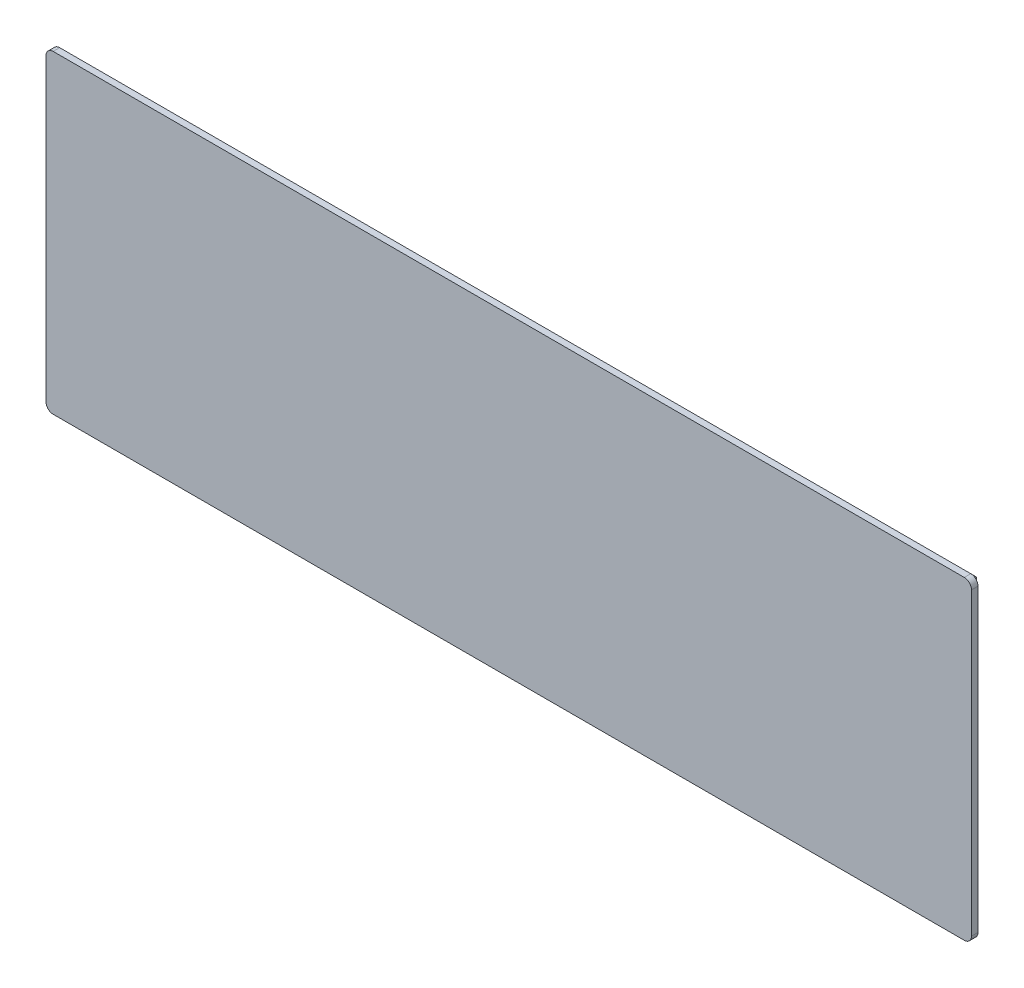
from build123d import *

# Parameters (mm, degrees)
DIGITIZER_DEPTH                               = 2.25
SKETCH2_W                                     = 315
SKETCH2_H                                     = 104
DISPLAY_INCLUDING_ADHESIVE_MARGIN_OF_5M_DEPTH = 2.5
SKETCH3_W                                     = 70
SKETCH3_H                                     = 2.5
DIGITIZER_CABLE_DEPTH                         = 2.5


with BuildPart() as part:
    # Sketch1 → DIGITIZER (new body)
    with BuildSketch(Plane.XY):
        with BuildLine():
            Line((-158, -54.5), (158, -54.5))
            ThreePointArc((158, -54.5), (159.767766953, -53.767766953), (160.5, -52))
            Line((160.5, -52), (160.5, 52))
            ThreePointArc((160.5, 52), (159.767766953, 53.767766953), (158, 54.5))
            Line((158, 54.5), (-158, 54.5))
            ThreePointArc((-158, 54.5), (-159.767766953, 53.767766953), (-160.5, 52))
            Line((-160.5, 52), (-160.5, -52))
            ThreePointArc((-160.5, -52), (-159.767766953, -53.767766953), (-158, -54.5))
        make_face()
    extrude(amount=DIGITIZER_DEPTH)

    # Sketch2 → DISPLAY INCLUDING ADHESIVE MARGIN OF .5MM (add)
    with BuildSketch(Plane(origin=(0, 0, 0), x_dir=(-1, 0, 0), z_dir=(0, 0, -1))):
        Rectangle(SKETCH2_W, SKETCH2_H)
    extrude(amount=DISPLAY_INCLUDING_ADHESIVE_MARGIN_OF_5M_DEPTH)

    # Sketch3 → DIGITIZER CABLE (add)
    with BuildSketch(Plane(origin=(0, 0, 0), x_dir=(-1, 0, 0), z_dir=(0, 0, -1))):
        with Locations((0, -53.25)):
            Rectangle(SKETCH3_W, SKETCH3_H)
    extrude(amount=DIGITIZER_CABLE_DEPTH)


solid = part.part
